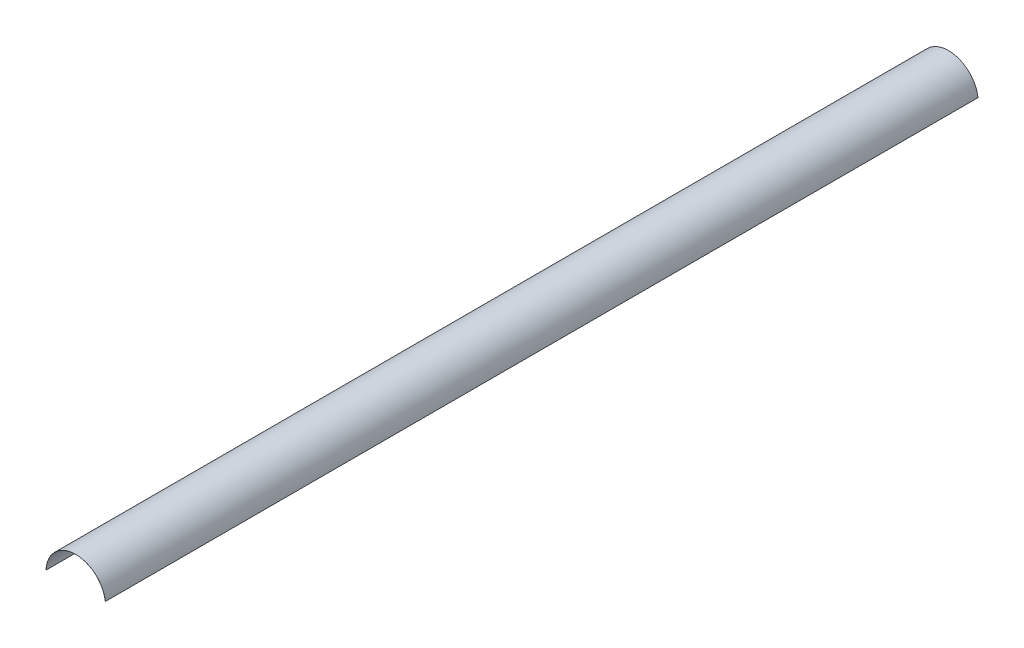
from build123d import *

# Parameters (mm, degrees)
EXTRUDE_THIN1_DEPTH = 3048


with BuildPart() as part:
    # Sketch1 → Extrude-Thin1 (new body)
    with BuildSketch(Plane.XY):
        with BuildLine():
            ThreePointArc((0, 0), (99.611485267, 99.593270993), (207.21155546, 8.689516842))
            Line((207.21155546, 8.689516842), (207.085560907, 8.673567777))
            ThreePointArc((207.085560907, 8.673567777), (99.616806397, 99.466382516), (0.126887502, -0.005344334))
            Line((0.126887502, -0.005344334), (0, 0))
        make_face()
    extrude(amount=EXTRUDE_THIN1_DEPTH)


solid = part.part
